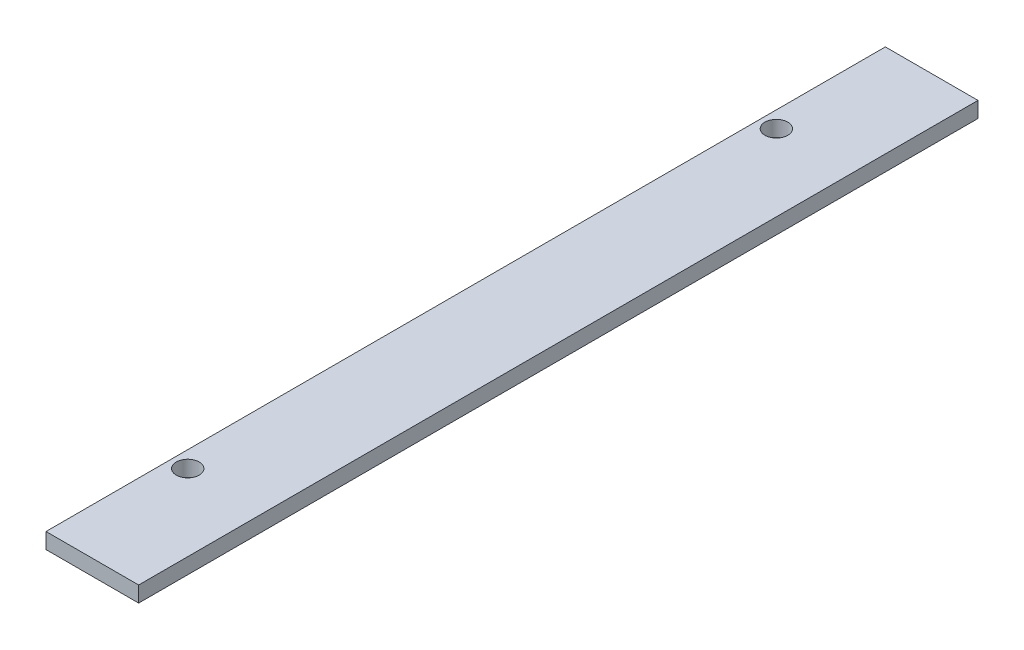
from build123d import *

# Parameters (mm, degrees)
SKETCH_1_W          = 8.5
SKETCH_1_H          = 77
EXTRUDE_1_DEPTH     = 1.44
SKETCH_2_R          = 1.05
CUT_EXTRUDE_1_DEPTH = 1.44


with BuildPart() as part:
    # 草图1 → 凸台-拉伸1 (new body)
    with BuildSketch(Plane(origin=(0, 0, 0), x_dir=(1, 0, 0), z_dir=(0, 1, 0))):
        with Locations((4.25, -38.5)):
            Rectangle(SKETCH_1_W, SKETCH_1_H)
    extrude(amount=EXTRUDE_1_DEPTH)

    # 草图2 → 切除-拉伸1 (cut)
    with BuildSketch(Plane(origin=(0, 1.44, 0), x_dir=(1, 0, 0), z_dir=(0, 1, 0))):
        with Locations(Location((1.5, -65.5, 0), (0, 0, 270))):
            Circle(SKETCH_2_R)
        with Locations(Location((1.5, -11.5, 0), (0, 0, 270))):
            Circle(SKETCH_2_R)
    extrude(amount=-CUT_EXTRUDE_1_DEPTH, mode=Mode.SUBTRACT)


solid = part.part
